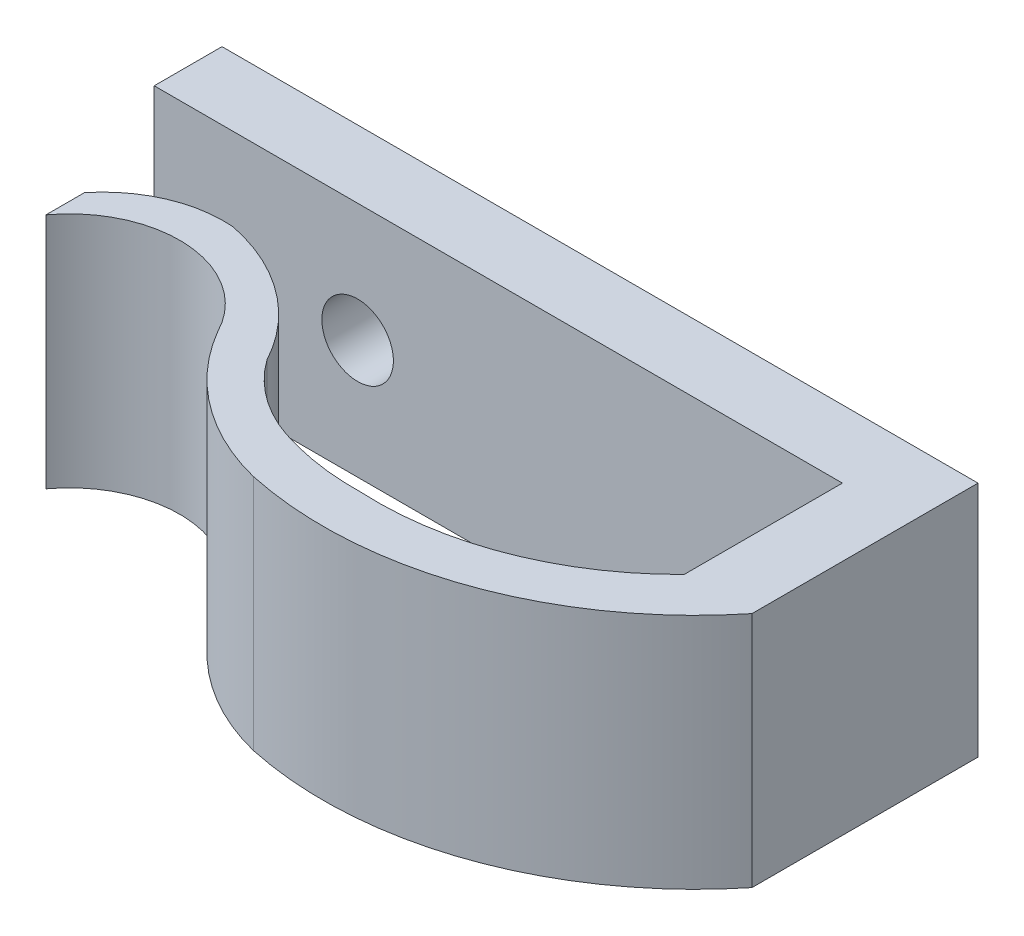
from build123d import *

# Parameters (mm, degrees)
SKETCH1_W           = 33.45
SKETCH1_H           = 10.5
BOSS_EXTRUDE1_DEPTH = 3
BOSS_EXTRUDE2_DEPTH = 10.5
CUT_EXTRUDE1_REACH  = 40.598
SKETCH3_R           = 1.5825


with BuildPart() as part:
    # Sketch1 → Boss-Extrude1 (new body)
    with BuildSketch(Plane.XY):
        with Locations((16.725, 5.25)):
            Rectangle(SKETCH1_W, SKETCH1_H)
    extrude(amount=BOSS_EXTRUDE1_DEPTH)

    # Sketch2 → Boss-Extrude2 (add)
    with BuildSketch(Plane.XZ):
        with BuildLine():
            Line((33.45, 3), (33.45, 10))
            ThreePointArc((33.45, 10), (26.127788274, 15.197537565), (17.167255211, 15.778939776))
            ThreePointArc((17.167255211, 15.778939776), (13.513268499, 14.036363917), (10.822706511, 11.011621661))
            ThreePointArc((10.822706511, 11.011621661), (6.874462981, 8.368470255), (2.551142404, 10.339199946))
            Line((2.551142404, 10.339199946), (2.551142404, 8.639199946))
            ThreePointArc((2.551142404, 8.639199946), (4.602955754, 7.079155178), (7.145952658, 6.658626408))
            ThreePointArc((7.145952658, 6.658626408), (10.559689681, 8.1799455), (12.998874454, 11.011621661))
            ThreePointArc((12.998874454, 11.011621661), (14.440986225, 12.472256001), (16.259204718, 13.424737261))
            ThreePointArc((16.259204718, 13.424737261), (18.189418616, 13.879021589), (20.168677104, 14))
            ThreePointArc((20.168677104, 14), (25.739491976, 13.10563656), (30.45, 10))
            Line((30.45, 10), (30.45, 3))
            Line((30.45, 3), (33.45, 3))
        make_face()
    extrude(amount=-BOSS_EXTRUDE2_DEPTH)

    # Sketch3 → Cut-Extrude1 (cut, up to next)
    with BuildSketch(Plane(origin=(0, 0, 0), x_dir=(-1, 0, 0), z_dir=(0, 0, -1)), mode=Mode.PRIVATE) as cut_extrude1_sk1:
        with Locations((-9, 5.25)):
            Circle(SKETCH3_R)
    cut_extrude1_tool1 = extrude(cut_extrude1_sk1.sketch, amount=-CUT_EXTRUDE1_REACH, mode=Mode.PRIVATE) & part.part
    add(cut_extrude1_tool1.solids().sort_by_distance((9, 5.25, 0))[0], mode=Mode.SUBTRACT)


solid = part.part
